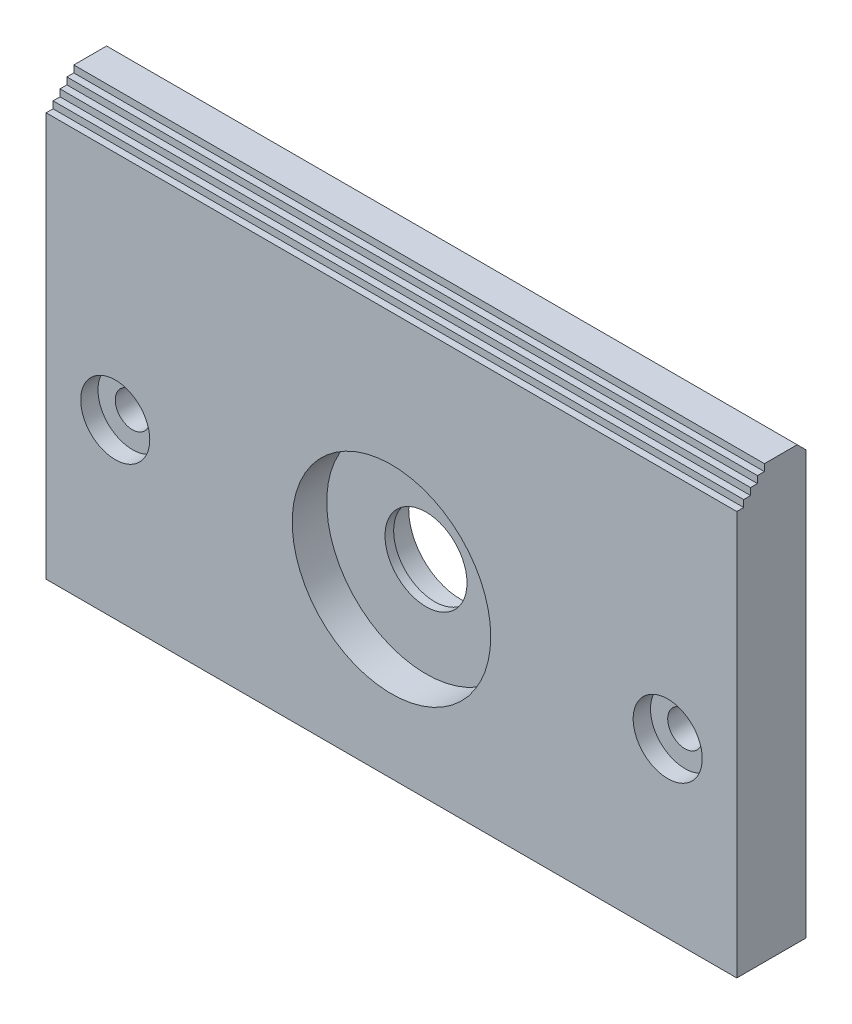
from build123d import *

# Parameters (mm, degrees)
SKETCH_1_W                     = 80
SKETCH_1_H                     = 60
EXTRUDE_1_DEPTH                = 8
HOLE_WIZARD_M3_5_1_D           = 4
HOLE_WIZARD_M3_5_1_CBORE_D     = 8
HOLE_WIZARD_M3_5_1_CBORE_DEPTH = 2
SKETCH_14_W                    = 80
SKETCH_14_H                    = 2
SKETCH_14_W_2                  = 2
SKETCH_14_H_2                  = 16
CUT_EXTRUDE_1_DEPTH            = 1
CUT_EXTRUDE_2_REACH            = 92.174
SKETCH_15_R                    = 4.75
SKETCH_17_R                    = 11.5
CUT_EXTRUDE_4_DEPTH            = 4
SKETCH_18_R                    = 6
CUT_EXTRUDE_5_DEPTH            = 3
CHAMFER_1_SIZE                 = 1.499999999
CHAMFER_1_SIZE2                = 1.500000001
CHAMFER_2_SIZE                 = 1
SKETCH_20_W                    = 80
SKETCH_20_H                    = 6
CUT_EXTRUDE_6_DEPTH            = 1
SKETCH_21_W                    = 80
SKETCH_21_H                    = 4
CUT_EXTRUDE_7_DEPTH            = 1
SKETCH_22_W                    = 80
SKETCH_22_H                    = 2
CUT_EXTRUDE_8_DEPTH            = 1
SKETCH_23_R                    = 1
CUT_EXTRUDE_9_DEPTH            = 1
CUT_EXTRUDE_10_REACH           = 92.174
SKETCH_24_W                    = 80
SKETCH_24_H                    = 10
SKETCH_25_W                    = 80
SKETCH_25_H                    = 18
EXTRUDE_2_DEPTH                = 3
CUT_EXTRUDE_11_REACH           = 92.174


with BuildPart() as part:
    # 草图1 → 凸台-拉伸1 (new body)
    with BuildSketch(Plane.XY.offset(8)):
        with Locations((40, 10.833333333)):
            Rectangle(SKETCH_1_W, SKETCH_1_H)
    extrude(amount=-EXTRUDE_1_DEPTH)

    # M3.5 六角头机械螺钉的柱形沉头孔1 (through all)
    with Locations(Plane.XY.offset(8)):
        with Locations((8, 10.833333333), (72, 10.833333333)):
            CounterBoreHole(HOLE_WIZARD_M3_5_1_D / 2, HOLE_WIZARD_M3_5_1_CBORE_D / 2, HOLE_WIZARD_M3_5_1_CBORE_DEPTH)

    # 草图14 → 切除-拉伸1 (cut)
    with BuildSketch(Plane.XY.offset(8)):
        with Locations((40, 37.833333333)):
            Rectangle(SKETCH_14_W, SKETCH_14_H)
        Polygon((15, 40.833333333), (31, 24.833333333), (32.414213562, 26.247546896), (16.414213562, 42.247546896), align=None)
        with Locations((7, 32.833333333)):
            Rectangle(SKETCH_14_W_2, SKETCH_14_H_2)
        with Locations((40, 32.833333333)):
            Rectangle(SKETCH_14_W_2, SKETCH_14_H_2)
        with Locations((73, 32.833333333)):
            Rectangle(SKETCH_14_W_2, SKETCH_14_H_2)
        Polygon((47.585786438, 26.247546896), (63.585786438, 42.247546896), (65, 40.833333333), (49, 24.833333333), align=None)
    extrude(amount=-CUT_EXTRUDE_1_DEPTH, mode=Mode.SUBTRACT)

    # 草图15 → 切除-拉伸2 (cut, up to next)
    with BuildSketch(Plane.XY.offset(8), mode=Mode.PRIVATE) as cut_extrude_2_sk1:
        with Locations((40, 10.833333333)):
            Circle(SKETCH_15_R)
    cut_extrude_2_tool1 = extrude(cut_extrude_2_sk1.sketch, amount=-CUT_EXTRUDE_2_REACH, mode=Mode.PRIVATE) & part.part
    add(cut_extrude_2_tool1.solids().sort_by_distance((40, 10.833333, 8))[0], mode=Mode.SUBTRACT)

    # 草图17 → 切除-拉伸4 (cut)
    with BuildSketch(Plane.XY.offset(8)):
        with Locations((40, 10.833333333)):
            Circle(SKETCH_17_R)
    extrude(amount=-CUT_EXTRUDE_4_DEPTH, mode=Mode.SUBTRACT)

    # 草图18 → 切除-拉伸5 (cut)
    with BuildSketch(Plane(origin=(0, 0, 0), x_dir=(-1, 0, 0), z_dir=(0, 0, -1))):
        with Locations((-40, 10.833333333)):
            Circle(SKETCH_18_R)
    extrude(amount=-CUT_EXTRUDE_5_DEPTH, mode=Mode.SUBTRACT)

    # 倒角1
    chamfer_1_edges = [part.edges().sort_by_distance(p)[0] for p in [
        (74, 10.833333333, 0),
        (10, 10.833333333, 0),
    ]]
    chamfer_1_side = [part.faces().sort_by_distance(p)[0] for p in [
        (79, 10.833333333, 0),
    ]]
    chamfer(chamfer_1_edges, length=CHAMFER_1_SIZE, length2=CHAMFER_1_SIZE2, reference=chamfer_1_side[0])

    # 倒角2
    chamfer_2_edges = [part.edges().sort_by_distance(p)[0] for p in [
        (40, 40.833333333, 0),
    ]]
    chamfer(chamfer_2_edges, length=CHAMFER_2_SIZE)

    # 草图20 → 切除-拉伸6 (cut)
    with BuildSketch(Plane.XY.offset(8)):
        with Locations((40, -16.166666667)):
            Rectangle(SKETCH_20_W, SKETCH_20_H)
    extrude(amount=-CUT_EXTRUDE_6_DEPTH, mode=Mode.SUBTRACT)

    # 草图21 → 切除-拉伸7 (cut)
    with BuildSketch(Plane.XY.offset(7)):
        with Locations((40, -17.166666667)):
            Rectangle(SKETCH_21_W, SKETCH_21_H)
    extrude(amount=-CUT_EXTRUDE_7_DEPTH, mode=Mode.SUBTRACT)

    # 草图22 → 切除-拉伸8 (cut)
    with BuildSketch(Plane.XY.offset(6)):
        with Locations((40, -18.166666667)):
            Rectangle(SKETCH_22_W, SKETCH_22_H)
    extrude(amount=-CUT_EXTRUDE_8_DEPTH, mode=Mode.SUBTRACT)

    # 草图23 → 切除-拉伸9 (cut)
    with BuildSketch(Plane.XY.offset(8)):
        with Locations((7, 24.833333333)):
            Circle(SKETCH_23_R)
        with Locations((31.707106781, 25.540440115)):
            Circle(SKETCH_23_R)
        with Locations((40, 24.833333333)):
            Circle(SKETCH_23_R)
        with Locations((48.292893219, 25.540440115)):
            Circle(SKETCH_23_R)
        with Locations((73, 24.833333333)):
            Circle(SKETCH_23_R)
    extrude(amount=-CUT_EXTRUDE_9_DEPTH, mode=Mode.SUBTRACT)

    # 草图24 → 切除-拉伸10 (cut, up to next)
    with BuildSketch(Plane.XY.offset(8), mode=Mode.PRIVATE) as cut_extrude_10_sk1:
        with Locations((40, -14.166666667)):
            Rectangle(SKETCH_24_W, SKETCH_24_H)
    cut_extrude_10_tool1 = extrude(cut_extrude_10_sk1.sketch, amount=-CUT_EXTRUDE_10_REACH, mode=Mode.PRIVATE) & part.part
    add(cut_extrude_10_tool1.solids().sort_by_distance((40, -14.166667, 8))[0], mode=Mode.SUBTRACT)

    # 草图25 → 凸台-拉伸2 (add)
    with BuildSketch(Plane.XY.offset(8)):
        with Locations((40, 31.833333333)):
            Rectangle(SKETCH_25_W, SKETCH_25_H)
    extrude(amount=-EXTRUDE_2_DEPTH)

    # 草图26 → 切除-拉伸11 (cut, up to next)
    with BuildSketch(Plane.ZY, mode=Mode.PRIVATE) as cut_extrude_11_sk1:
        Polygon((4.8, 40.833333333), (4.8, 40.033333333), (5.6, 40.033333333), (5.6, 39.233333333), (6.4, 39.233333333), (6.4, 38.433333333), (7.2, 38.433333333), (7.2, 37.633333333), (8, 37.633333333), (8, 40.833333333), align=None)
    cut_extrude_11_tool1 = extrude(cut_extrude_11_sk1.sketch, amount=-CUT_EXTRUDE_11_REACH, mode=Mode.PRIVATE) & part.part
    add(cut_extrude_11_tool1.solids().sort_by_distance((0, 39.633333, 6.8))[0], mode=Mode.SUBTRACT)


solid = part.part
